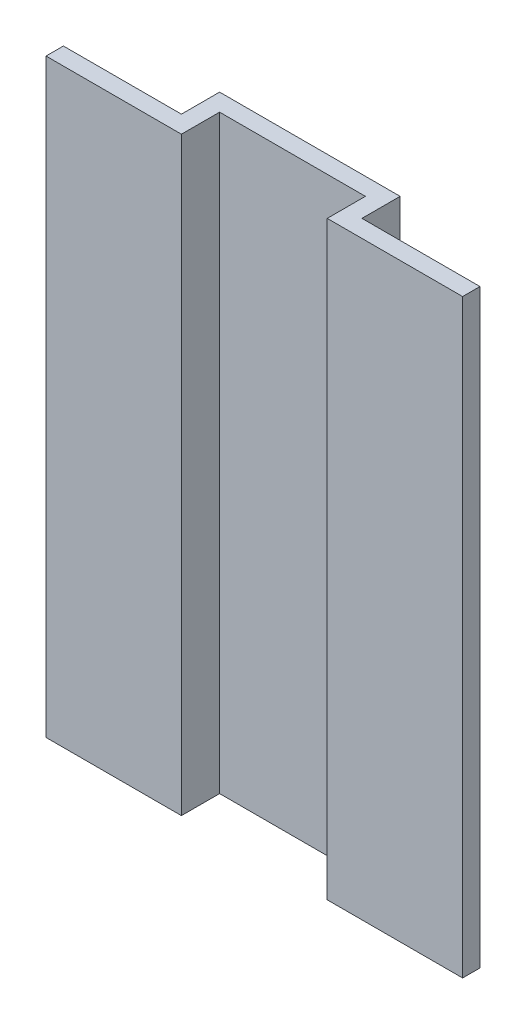
from build123d import *

# Parameters (mm, degrees)
BOSS_EXTRUDE1_DEPTH = 85


with BuildPart() as part:
    # Sketch1 → Boss-Extrude1 (new, symmetric)
    with BuildSketch(Plane(origin=(0, 0, 0), x_dir=(1, 0, 0), z_dir=(0, 1, 0))):
        Polygon((-60, -5), (-21, -5), (-21, 6), (21, 6), (21, -5), (60, -5), (60, 0), (26, 0), (26, 11), (-26, 11), (-26, 0), (-60, 0), align=None)
    extrude(amount=BOSS_EXTRUDE1_DEPTH, both=True)


solid = part.part
